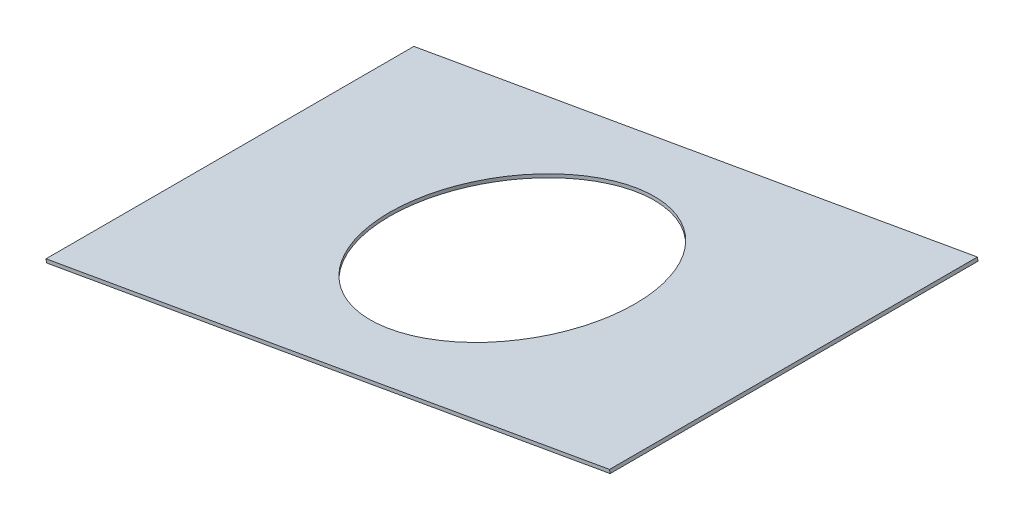
from build123d import *

# Parameters (mm, degrees)
BOSS_EXTRUDE1_DEPTH = 270
CUT_EXTRUDE1_REACH  = 509.382
SKETCH2_R           = 180


with BuildPart() as part:
    # Sketch1 → Boss-Extrude1 (new, symmetric)
    with BuildSketch(Plane.XY):
        Polygon((-414.487497153, -33.008195855), (412.751015377, 112.856273385), (413.619256265, 107.93223462), (-413.619256265, -37.93223462), align=None)
    extrude(amount=BOSS_EXTRUDE1_DEPTH, both=True)

    # Cut-Extrude1: up to this face of the body (flat: up to its plane)
    cut_extrude1_end = Plane(part.part.faces().sort_by_distance((-0.868240888, 39.924038765, 0))[0])
    # Sketch2 → Cut-Extrude1 (cut, up to the picked face)
    with BuildSketch(Plane(origin=(0, 0, 0), x_dir=(1, 0, 0), z_dir=(0, 1, 0)), mode=Mode.PRIVATE) as cut_extrude1_sk1:
        with Locations(Location((0, 0, 0), (0, 0, 180))):
            Circle(SKETCH2_R)
    cut_extrude1_tool1 = split(extrude(cut_extrude1_sk1.sketch, amount=CUT_EXTRUDE1_REACH, mode=Mode.PRIVATE), bisect_by=cut_extrude1_end, keep=Keep.BOTH, mode=Mode.PRIVATE)
    add(cut_extrude1_tool1.solids().sort_by(Axis((0, 0, 0), (0, 1, 0)))[0], mode=Mode.SUBTRACT)


solid = part.part
